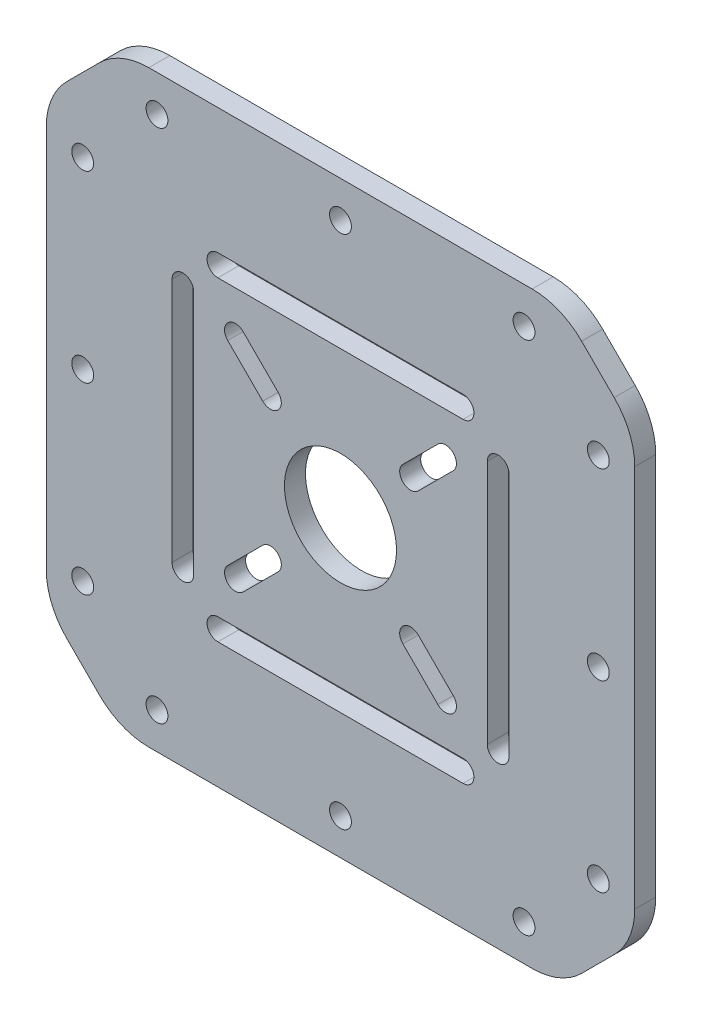
from build123d import *

# Parameters (mm, degrees)
SKETCH_1_R      = 8
SKETCH_1_R_2    = 1.56
EXTRUDE_1_DEPTH = 3


with BuildPart() as part:
    # 草图1 → 凸台-拉伸1 (new body)
    with BuildSketch(Plane.XY):
        with BuildLine():
            Line((-27.357864376, 42), (27.357864376, 42))
            ThreePointArc((27.357864376, 42), (31.1846987, 41.238795325), (34.428932188, 39.071067812))
            Line((34.428932188, 39.071067812), (39.071067812, 34.428932188))
            ThreePointArc((39.071067812, 34.428932188), (41.238795325, 31.1846987), (42, 27.357864376))
            Line((42, 27.357864376), (42, -27.357864376))
            ThreePointArc((42, -27.357864376), (41.238795325, -31.1846987), (39.071067812, -34.428932188))
            Line((39.071067812, -34.428932188), (34.428932188, -39.071067812))
            ThreePointArc((34.428932188, -39.071067812), (31.1846987, -41.238795325), (27.357864376, -42))
            Line((27.357864376, -42), (-27.357864376, -42))
            ThreePointArc((-27.357864376, -42), (-31.1846987, -41.238795325), (-34.428932188, -39.071067812))
            Line((-34.428932188, -39.071067812), (-39.071067812, -34.428932188))
            ThreePointArc((-39.071067812, -34.428932188), (-41.238795325, -31.1846987), (-42, -27.357864376))
            Line((-42, -27.357864376), (-42, 27.357864376))
            ThreePointArc((-42, 27.357864376), (-41.238795325, 31.1846987), (-39.071067812, 34.428932188))
            Line((-39.071067812, 34.428932188), (-34.428932188, 39.071067812))
            ThreePointArc((-34.428932188, 39.071067812), (-31.1846987, 41.238795325), (-27.357864376, 42))
        make_face()
        Circle(SKETCH_1_R, mode=Mode.SUBTRACT)
        with Locations((-26.196699141, 36.803300859)):
            Circle(SKETCH_1_R_2, mode=Mode.SUBTRACT)
        with Locations((-36.803300859, 26.196699141)):
            Circle(SKETCH_1_R_2, mode=Mode.SUBTRACT)
        with Locations(Location((26.196699141, 36.803300859, 0), (0, 0, 180))):
            Circle(SKETCH_1_R_2, mode=Mode.SUBTRACT)
        with Locations(Location((36.803300859, 26.196699141, 0), (0, 0, 180))):
            Circle(SKETCH_1_R_2, mode=Mode.SUBTRACT)
        with Locations((36.803300859, -26.196699141)):
            Circle(SKETCH_1_R_2, mode=Mode.SUBTRACT)
        with Locations((26.196699141, -36.803300859)):
            Circle(SKETCH_1_R_2, mode=Mode.SUBTRACT)
        with Locations(Location((-26.196699141, -36.803300859, 0), (0, 0, 180))):
            Circle(SKETCH_1_R_2, mode=Mode.SUBTRACT)
        with Locations(Location((-36.803300859, -26.196699141, 0), (0, 0, 180))):
            Circle(SKETCH_1_R_2, mode=Mode.SUBTRACT)
        with Locations((0, 36.803300859)):
            Circle(SKETCH_1_R_2, mode=Mode.SUBTRACT)
        with Locations(Location((36.803300859, 0, 0), (0, 0, 180))):
            Circle(SKETCH_1_R_2, mode=Mode.SUBTRACT)
        with Locations(Location((0, -36.803300859, 0), (0, 0, 180))):
            Circle(SKETCH_1_R_2, mode=Mode.SUBTRACT)
        with Locations((-36.803300859, 0)):
            Circle(SKETCH_1_R_2, mode=Mode.SUBTRACT)
        with BuildLine():
            Line((-17.5, 24.05), (17.5, 24.05))
            ThreePointArc((17.5, 24.05), (19.05, 22.5), (17.5, 20.95))
            Line((17.5, 20.95), (-17.5, 20.95))
            ThreePointArc((-17.5, 20.95), (-19.05, 22.5), (-17.5, 24.05))
        make_face(mode=Mode.SUBTRACT)
        with BuildLine():
            Line((-17.5, -24.05), (17.5, -24.05))
            ThreePointArc((17.5, -24.05), (19.05, -22.5), (17.5, -20.95))
            Line((17.5, -20.95), (-17.5, -20.95))
            ThreePointArc((-17.5, -20.95), (-19.05, -22.5), (-17.5, -24.05))
        make_face(mode=Mode.SUBTRACT)
        with BuildLine():
            Line((24.05, -17.5), (24.05, 17.5))
            ThreePointArc((24.05, 17.5), (22.5, 19.05), (20.95, 17.5))
            Line((20.95, 17.5), (20.95, -17.5))
            ThreePointArc((20.95, -17.5), (22.5, -19.05), (24.05, -17.5))
        make_face(mode=Mode.SUBTRACT)
        with BuildLine():
            Line((-24.05, -17.5), (-24.05, 17.5))
            ThreePointArc((-24.05, 17.5), (-22.5, 19.05), (-20.95, 17.5))
            Line((-20.95, 17.5), (-20.95, -17.5))
            ThreePointArc((-20.95, -17.5), (-22.5, -19.05), (-24.05, -17.5))
        make_face(mode=Mode.SUBTRACT)
        with BuildLine():
            Line((8.903984489, 11.096015511), (13.903984489, 16.096015511))
            ThreePointArc((13.903984489, 16.096015511), (16.096015511, 16.096015511), (16.096015511, 13.903984489))
            Line((16.096015511, 13.903984489), (11.096015511, 8.903984489))
            ThreePointArc((11.096015511, 8.903984489), (8.903984489, 8.903984489), (8.903984489, 11.096015511))
        make_face(mode=Mode.SUBTRACT)
        with BuildLine():
            Line((-8.903984489, 11.096015511), (-13.903984489, 16.096015511))
            ThreePointArc((-13.903984489, 16.096015511), (-16.096015511, 16.096015511), (-16.096015511, 13.903984489))
            Line((-16.096015511, 13.903984489), (-11.096015511, 8.903984489))
            ThreePointArc((-11.096015511, 8.903984489), (-8.903984489, 8.903984489), (-8.903984489, 11.096015511))
        make_face(mode=Mode.SUBTRACT)
        with BuildLine():
            Line((-8.903984489, -11.096015511), (-13.903984489, -16.096015511))
            ThreePointArc((-13.903984489, -16.096015511), (-16.096015511, -16.096015511), (-16.096015511, -13.903984489))
            Line((-16.096015511, -13.903984489), (-11.096015511, -8.903984489))
            ThreePointArc((-11.096015511, -8.903984489), (-8.903984489, -8.903984489), (-8.903984489, -11.096015511))
        make_face(mode=Mode.SUBTRACT)
        with BuildLine():
            Line((8.903984489, -11.096015511), (13.903984489, -16.096015511))
            ThreePointArc((13.903984489, -16.096015511), (16.096015511, -16.096015511), (16.096015511, -13.903984489))
            Line((16.096015511, -13.903984489), (11.096015511, -8.903984489))
            ThreePointArc((11.096015511, -8.903984489), (8.903984489, -8.903984489), (8.903984489, -11.096015511))
        make_face(mode=Mode.SUBTRACT)
    extrude(amount=EXTRUDE_1_DEPTH)


solid = part.part
